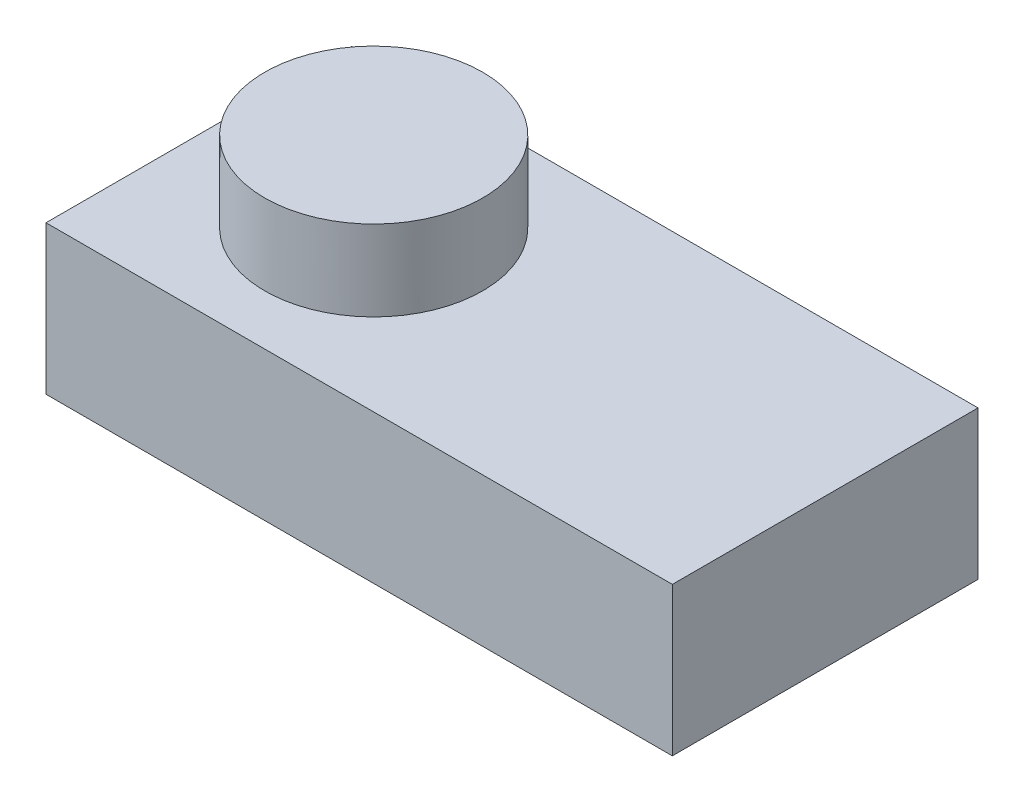
from build123d import *

# Parameters (mm, degrees)
IZIM1_W                     = 101.194983934
IZIM1_H                     = 49.38315216
Y_KSEKLIK_EKSTR_ZYON2_DEPTH = 24
G_VDE_TA_KOPYALA1_ANGLE     = 90
IZIM2_R                     = 17.60947899
Y_KSEKLIK_EKSTR_ZYON4_DEPTH = 13


with BuildPart() as part:
    # Çizim1 → Yükseklik-Ekstrüzyon2 (new body)
    with BuildSketch(Plane.XY):
        with Locations((38.049313959, -10.524278329)):
            Rectangle(IZIM1_W, IZIM1_H)
    extrude(amount=Y_KSEKLIK_EKSTR_ZYON2_DEPTH)


with BuildPart() as part_1:
    # Gövde-Taşı/Kopyala1: moved
    add(part.part.rotate(Axis((0, -10.524278329, 12), (1, 0, 0)), G_VDE_TA_KOPYALA1_ANGLE))

    # Çizim2 → Yükseklik-Ekstrüzyon4 (add)
    with BuildSketch(Plane(origin=(0, 1.475721671, 0), x_dir=(1, 0, 0), z_dir=(0, 1, 0))):
        with Locations(Location((14.659162211, -10.95067627, 0), (0, 0, 90))):
            Circle(IZIM2_R)
    extrude(amount=Y_KSEKLIK_EKSTR_ZYON4_DEPTH)


solid = part_1.part
